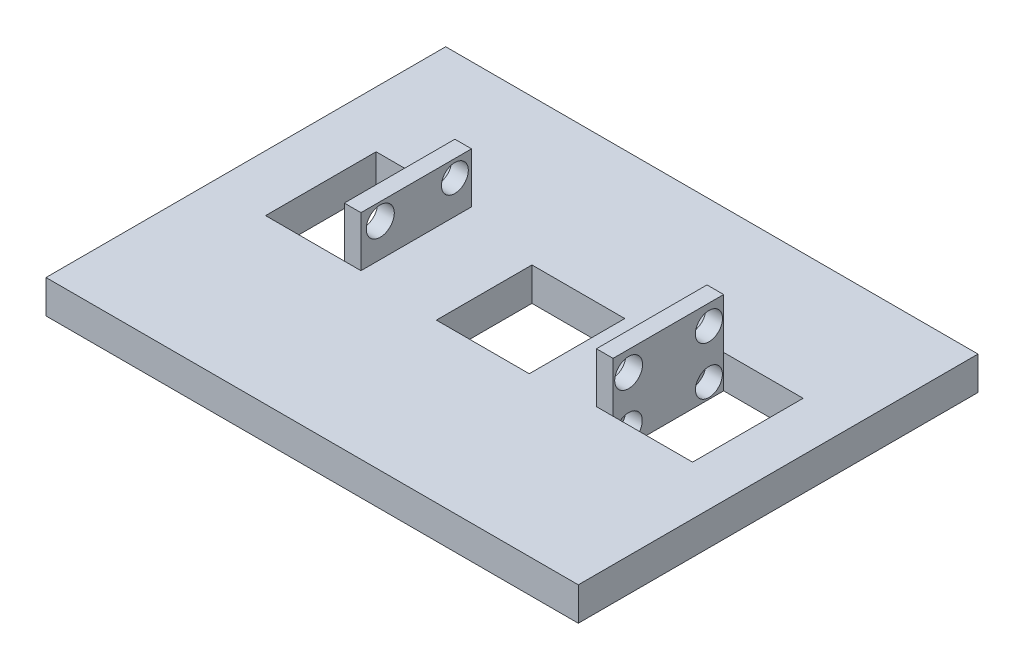
from build123d import *

# Parameters (mm, degrees)
SKETCH3_W               = 159.804878049
SKETCH3_H               = 120
BOSS_EXTRUDE1_DEPTH     = 10
CUT_EXTRUDE1_DEPTH      = 20
CUT_EXTRUDE3_DEPTH      = 10
CUT_EXTRUDE3_DEPTH_BACK = 16
SKETCH5_R               = 3
CUT_EXTRUDE6_DEPTH      = 10
SKETCH8_R               = 4.027386095
SKETCH8_R_2             = 4.205627654
SKETCH8_R_3             = 4.039456984
SKETCH8_R_4             = 4.036176238
BOSS_EXTRUDE3_DEPTH     = 5
SKETCH9_W               = 33.196532324
SKETCH9_H               = 25.056213838
SKETCH9_R               = 4.18060077
SKETCH9_R_2             = 4.080354001
SKETCH9_R_3             = 4.086165431
SKETCH9_R_4             = 4.036615778
BOSS_EXTRUDE4_DEPTH     = 5


with BuildPart() as part:
    # Sketch3 → Boss-Extrude1 (new body)
    with BuildSketch(Plane(origin=(0, 0, 0), x_dir=(1, 0, 0), z_dir=(0, 1, 0))):
        with Locations((34.390243903, -22.243902439)):
            Rectangle(SKETCH3_W, SKETCH3_H)
    extrude(amount=BOSS_EXTRUDE1_DEPTH)

    # Sketch4 → Cut-Extrude1 (cut)
    with BuildSketch(Plane(origin=(0, 10, 0), x_dir=(1, 0, 0), z_dir=(0, 1, 0))):
        Polygon((52.048199058, -16.00595694), (52.048199058, -34.721676718), (24.165287655, -34.721676718), (24.165287655, -6.031004918), (52.048199058, -6.031004918), align=None)
    extrude(amount=-CUT_EXTRUDE1_DEPTH, mode=Mode.SUBTRACT)

    # Sketch5 → Cut-Extrude3 (cut, two sides: drawn at the far end of the back side and taken through both)
    with BuildSketch(Plane(origin=(0, 10, 0), x_dir=(1, 0, 0), z_dir=(0, 1, 0)).offset(-CUT_EXTRUDE3_DEPTH_BACK)):
        with Locations(Location((-15.512195122, -22.243902439, 0), (0, 0, 270))):
            Circle(SKETCH5_R)
        with Locations(Location((84.292682927, -22.243902439, 0), (0, 0, 270))):
            Circle(SKETCH5_R)
    extrude(amount=CUT_EXTRUDE3_DEPTH + CUT_EXTRUDE3_DEPTH_BACK, mode=Mode.SUBTRACT)

    # Sketch7 → Cut-Extrude6 (cut)
    with BuildSketch(Plane(origin=(0, 10, 0), x_dir=(1, 0, 0), z_dir=(0, 1, 0))):
        Polygon((-6.403519992, -33.196532324), (0, -33.196532324), (0, 0), (-6.403519992, 0), (-28.646264147, 0), (-28.646264147, -33.196532324), align=None)
        Polygon((70.689603866, -33.196532324), (77.304662661, -33.196532324), (99.548678473, -33.196532324), (99.548678473, 0), (77.304662661, 0), (70.689603866, 0), align=None)
    extrude(amount=-CUT_EXTRUDE6_DEPTH, mode=Mode.SUBTRACT)

    # Sketch8 → Boss-Extrude3 (add)
    with BuildSketch(Plane.ZY):
        Polygon((0, 0), (0, 25.089225982), (33.196532324, 25.089225982), (33.196532324, 22.465752332), (33.196532324, 0), align=None)
        with Locations((4.999328758, 20.009772327)):
            Circle(SKETCH8_R, mode=Mode.SUBTRACT)
        with Locations((27.400871365, 20.009772327)):
            Circle(SKETCH8_R_2, mode=Mode.SUBTRACT)
        with Locations((4.999328758, 4.193672126)):
            Circle(SKETCH8_R_3, mode=Mode.SUBTRACT)
        with Locations((27.400871365, 4.193672126)):
            Circle(SKETCH8_R_4, mode=Mode.SUBTRACT)
    extrude(amount=BOSS_EXTRUDE3_DEPTH)

    # Sketch9 → Boss-Extrude4 (add)
    with BuildSketch(Plane(origin=(70.689603866, 0, 0), x_dir=(0, 0, -1), z_dir=(1, 0, 0))):
        with Locations((-16.598266162, 12.528106919)):
            Rectangle(SKETCH9_W, SKETCH9_H)
        with Locations((-28.524013472, 19.041369902)):
            Circle(SKETCH9_R, mode=Mode.SUBTRACT)
        with Locations((-4.413648361, 19.041369902)):
            Circle(SKETCH9_R_2, mode=Mode.SUBTRACT)
        with Locations((-28.524013472, 4.530421359)):
            Circle(SKETCH9_R_3, mode=Mode.SUBTRACT)
        with Locations((-4.413648361, 4.530421359)):
            Circle(SKETCH9_R_4, mode=Mode.SUBTRACT)
    extrude(amount=BOSS_EXTRUDE4_DEPTH)


solid = part.part
